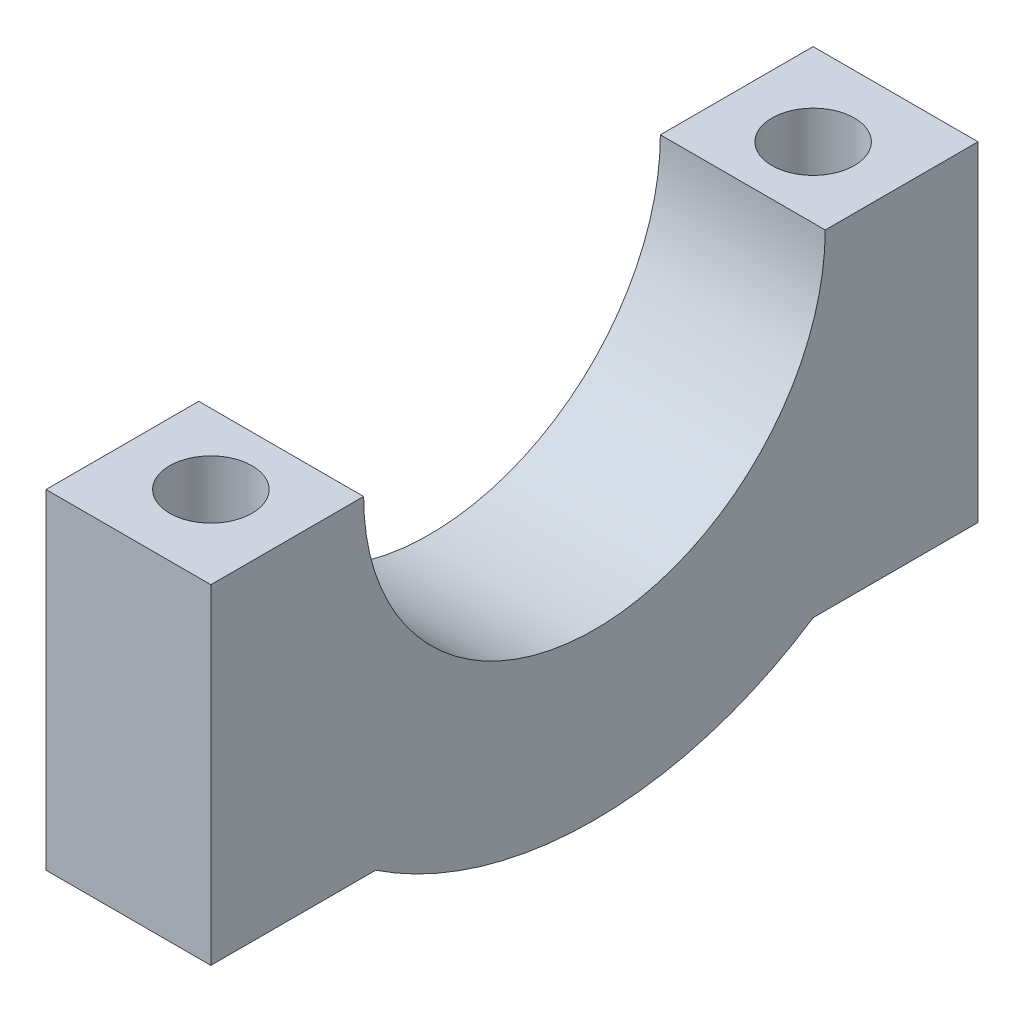
from build123d import *

# Parameters (mm, degrees)
BOSS_EXTRUDE1_DEPTH = 12.7
SKETCH2_R           = 3.175
CUT_EXTRUDE1_DEPTH  = 41.982449048


with BuildPart() as part:
    # Sketch1 → Boss-Extrude1 (new body)
    with BuildSketch(Plane(origin=(0, 0, 0), x_dir=(0, 0, -1), z_dir=(1, 0, 0))):
        with BuildLine():
            Line((-17.78, 0), (-29.548453935, 0))
            Line((-29.548453935, 0), (-29.548453935, -25.4))
            Line((-29.548453935, -25.4), (-16.848453935, -25.4))
            ThreePointArc((-16.848453935, -25.4), (0, -30.48), (16.848453935, -25.4))
            Line((16.848453935, -25.4), (29.548453935, -25.4))
            Line((29.548453935, -25.4), (29.548453935, 0))
            Line((29.548453935, 0), (17.78, 0))
            ThreePointArc((17.78, 0), (0, -17.78), (-17.78, 0))
        make_face()
    extrude(amount=BOSS_EXTRUDE1_DEPTH)

    # Sketch2 → Cut-Extrude1 (cut, through all)
    with BuildSketch(Plane.XZ.offset(25.4)):
        with Locations(Location((6.35, 23.198453935, 0), (0, 0, 270))):
            Circle(SKETCH2_R)
        with Locations(Location((6.35, -23.198453935, 0), (0, 0, 90))):
            Circle(SKETCH2_R)
    extrude(amount=-CUT_EXTRUDE1_DEPTH, mode=Mode.SUBTRACT)


solid = part.part
